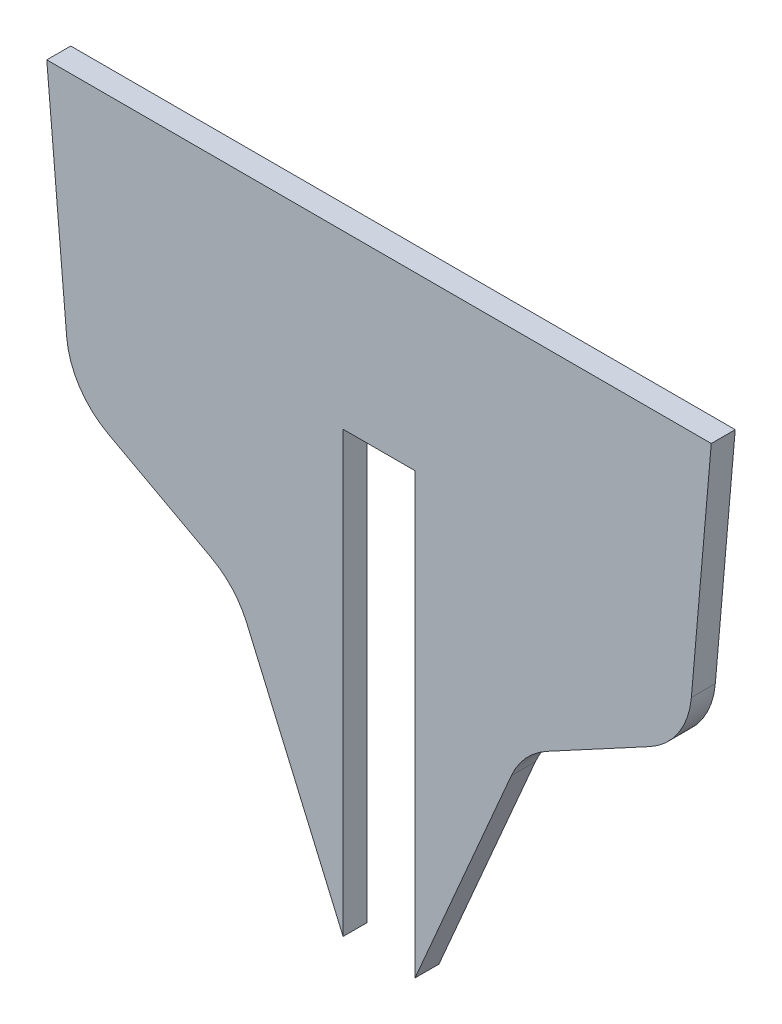
from build123d import *

# Parameters (mm, degrees)
BOSS_EXTRU_1_DEPTH = 3
CONG_1_R           = 10


with BuildPart() as part:
    # Esquisse1 → Boss.-Extru.1 (new body)
    with BuildSketch(Plane.XY):
        Polygon((11.917194627, -65.85290432), (11.917194627, -10.85290432), (2.917194627, -10.85290432), (2.917194627, -65.85290432), (-10.53158391, -34.67577833), (-31.222461176, -23.509273139), (-34.178300785, 10.64709568), (49.012690039, 10.64709568), (46.05685043, -23.509273139), (25.365973164, -34.67577833), align=None)
    extrude(amount=BOSS_EXTRU_1_DEPTH)

    # Congé1
    cong_1_edges = [part.edges().sort_by_distance(p)[0] for p in [
        (-10.53158391, -34.67577833, 1.5),
        (-31.222461176, -23.509273139, 1.5),
        (46.05685043, -23.509273139, 1.5),
        (25.365973164, -34.67577833, 1.5),
    ]]
    fillet(cong_1_edges, radius=CONG_1_R)


solid = part.part
